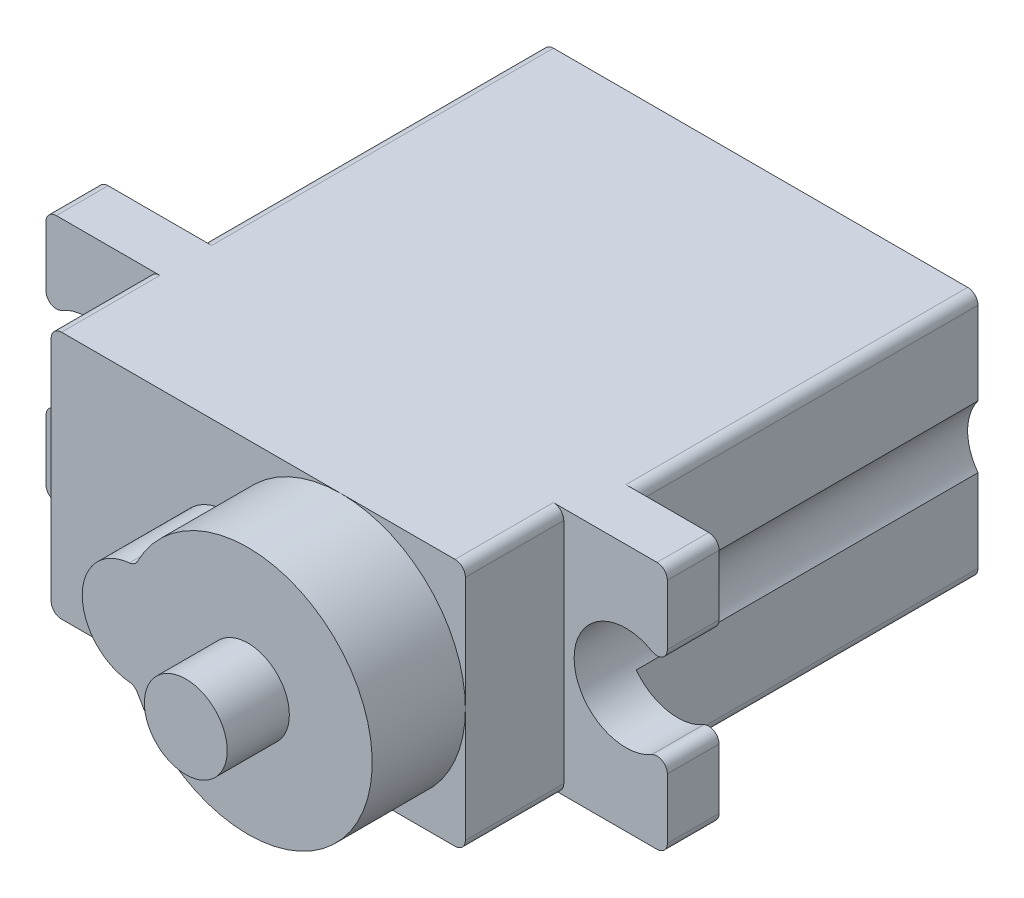
from build123d import *

# Parameters (mm, degrees)
SKETCH1_W           = 12
SKETCH1_H           = 21
BOSS_EXTRUDE1_DEPTH = 16.5
BOSS_EXTRUDE2_DEPTH = 2.5
SKETCH3_W           = 20
SKETCH3_H           = 12
BOSS_EXTRUDE3_DEPTH = 4.75
BOSS_EXTRUDE4_DEPTH = 4.5
SKETCH5_R           = 2
BOSS_EXTRUDE5_DEPTH = 3
CUT_EXTRUDE1_START  = -19
SKETCH7_R           = 2.5
CUT_EXTRUDE1_DEPTH  = 19
FILLET1_R           = 0.5


with BuildPart() as part:
    # Sketch1 → Boss-Extrude1 (new body)
    with BuildSketch(Plane(origin=(0, 0, 0), x_dir=(0, 1, 0), z_dir=(0, 0, 1))):
        with Locations((0.975124378, -3.111940299)):
            Rectangle(SKETCH1_W, SKETCH1_H)
    extrude(amount=BOSS_EXTRUDE1_DEPTH)

    # Sketch2 → Boss-Extrude2 (add)
    with BuildSketch(Plane.XY.offset(16.5)):
        Polygon((-7.388059701, 6.975124378), (-12.388059701, 6.975124378), (-12.388059701, -5.024875622), (-7.388059701, -5.024875622), (13.611940299, -5.024875622), (17.611940299, -5.024875622), (17.611940299, 6.975124378), (12.611940299, 6.975124378), align=None)
    extrude(amount=BOSS_EXTRUDE2_DEPTH)

    # Sketch3 → Boss-Extrude3 (add)
    with BuildSketch(Plane.XY.offset(19)):
        with Locations((2.611940299, 0.975124378)):
            Rectangle(SKETCH3_W, SKETCH3_H)
    extrude(amount=BOSS_EXTRUDE3_DEPTH)

    # Sketch4 → Boss-Extrude4 (add)
    with BuildSketch(Plane.XY.offset(23.75)):
        with BuildLine():
            ThreePointArc((1.157394845, -1.524462367), (12.611940299, 0.975124378), (1.157394845, 3.474711123))
            ThreePointArc((1.157394845, 3.474711123), (-1.388059703, 0.975124378), (1.157394845, -1.524462367))
        make_face()
    extrude(amount=BOSS_EXTRUDE4_DEPTH)

    # Sketch7 → Cut-Extrude1 (cut)
    with BuildSketch(Plane.XY.offset(19).offset(CUT_EXTRUDE1_START)):
        with Locations((15.611940299, 0.975124378)):
            Circle(SKETCH7_R)
        with Locations((-10.388059701, 0.975124378)):
            Circle(SKETCH7_R)
    extrude(amount=CUT_EXTRUDE1_DEPTH, mode=Mode.SUBTRACT)

    # Fillet1
    fillet1_edges = [part.edges().sort_by_distance(p)[0] for p in [
        (-12.388059701, 6.975124378, 17.75),
        (-12.388059701, -5.024875622, 17.75),
        (17.611940299, -5.024875622, 17.75),
        (17.611940299, 6.975124378, 17.75),
        (-7.388059701, 6.975124378, 21.375),
        (-7.388059701, -5.024875622, 21.375),
        (12.611940299, -5.024875622, 21.375),
        (12.611940299, 6.975124378, 21.375),
        (1.157394845, 3.474711123, 26),
        (1.157394845, -1.524462367, 26),
        (17.611940299, -0.524875622, 17.75),
        (17.611940299, 2.475124378, 17.75),
        (-12.388059701, 2.475124378, 17.75),
        (-12.388059701, -0.524875622, 17.75),
        (13.611940299, 6.975124378, 8.25),
        (13.611940299, -5.024875622, 8.25),
        (-7.388059701, -5.024875622, 8.25),
        (-7.388059701, 6.975124378, 8.25),
    ]]
    fillet(fillet1_edges, radius=FILLET1_R)


with BuildPart() as body_2:
    # Sketch5 → Boss-Extrude5 (new body)
    with BuildSketch(Plane.XY.offset(28.25)):
        with Locations((6.611940299, 0.975124378)):
            Circle(SKETCH5_R)
    extrude(amount=BOSS_EXTRUDE5_DEPTH)


solid = Compound([part.part, body_2.part])
